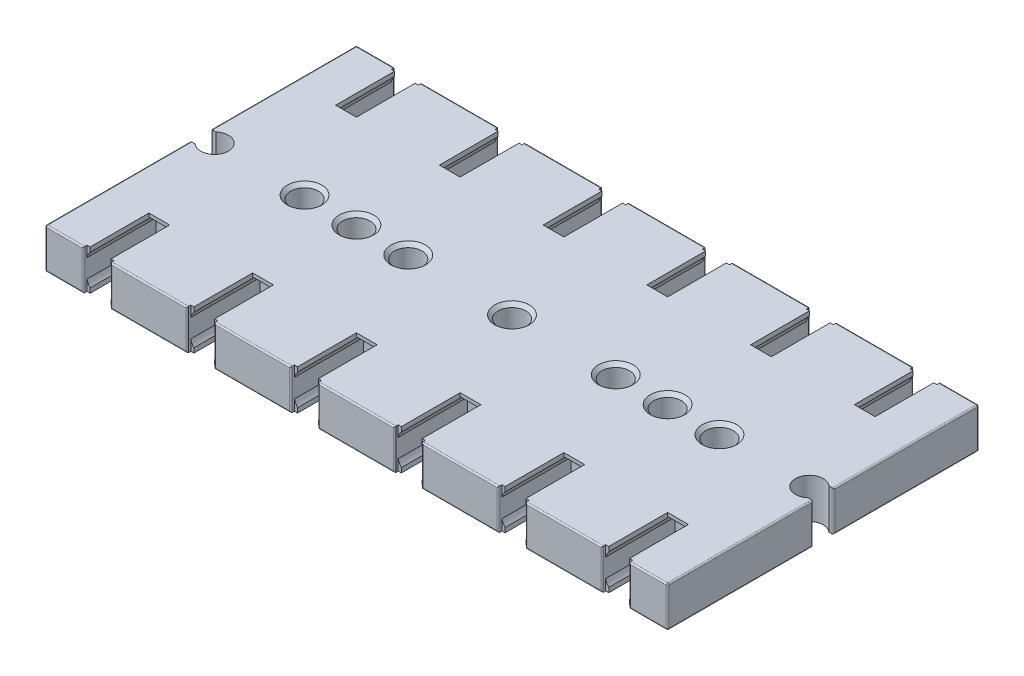
from build123d import *

# Parameters (mm, degrees)
SKETCH_1_W                        = 90
SKETCH_1_H                        = 45
EXTRUDE_1_DEPTH                   = 5.8
CUT_EXTRUDE_2_DEPTH               = 10.5
SKETCH_3_W                        = 3.9
SKETCH_3_H                        = 5.8
CUT_EXTRUDE_3_DEPTH               = 0.5
SKETCH_4_W                        = 3
SKETCH_4_H                        = 0.5
EXTRUDE_2_DEPTH                   = 1.5
PATTERN_LINEAR_1_COUNT            = 6
PATTERN_LINEAR_1_PITCH            = 15
PATTERN_LINEAR_1_COPY_1_DEPTH     = 10.5
PATTERN_LINEAR_1_COPY_2_DEPTH     = 10.5
PATTERN_LINEAR_1_COPY_3_DEPTH     = 10.5
PATTERN_LINEAR_1_COPY_4_DEPTH     = 10.5
PATTERN_LINEAR_1_COPY_5_DEPTH     = 10.5
PATTERN_LINEAR_1_COPY_6_SKETCH_W  = 3.9
PATTERN_LINEAR_1_COPY_6_SKETCH_H  = 5.8
PATTERN_LINEAR_1_COPY_6_DEPTH     = 0.5
PATTERN_LINEAR_1_COPY_7_SKETCH_W  = 3.9
PATTERN_LINEAR_1_COPY_7_SKETCH_H  = 5.8
PATTERN_LINEAR_1_COPY_7_DEPTH     = 0.5
PATTERN_LINEAR_1_COPY_8_SKETCH_W  = 3.9
PATTERN_LINEAR_1_COPY_8_SKETCH_H  = 5.8
PATTERN_LINEAR_1_COPY_8_DEPTH     = 0.5
PATTERN_LINEAR_1_COPY_9_SKETCH_W  = 3.9
PATTERN_LINEAR_1_COPY_9_SKETCH_H  = 5.8
PATTERN_LINEAR_1_COPY_9_DEPTH     = 0.5
PATTERN_LINEAR_1_COPY_10_SKETCH_W = 3.9
PATTERN_LINEAR_1_COPY_10_SKETCH_H = 5.8
PATTERN_LINEAR_1_COPY_10_DEPTH    = 0.5
PATTERN_LINEAR_1_COPY_11_SKETCH_W = 3
PATTERN_LINEAR_1_COPY_11_SKETCH_H = 0.5
PATTERN_LINEAR_1_COPY_11_DEPTH    = 1.5
PATTERN_LINEAR_1_COPY_12_SKETCH_W = 3
PATTERN_LINEAR_1_COPY_12_SKETCH_H = 0.5
PATTERN_LINEAR_1_COPY_12_DEPTH    = 1.5
PATTERN_LINEAR_1_COPY_13_SKETCH_W = 3
PATTERN_LINEAR_1_COPY_13_SKETCH_H = 0.5
PATTERN_LINEAR_1_COPY_13_DEPTH    = 1.5
PATTERN_LINEAR_1_COPY_14_SKETCH_W = 3
PATTERN_LINEAR_1_COPY_14_SKETCH_H = 0.5
PATTERN_LINEAR_1_COPY_14_DEPTH    = 1.5
PATTERN_LINEAR_1_COPY_15_SKETCH_W = 3
PATTERN_LINEAR_1_COPY_15_SKETCH_H = 0.5
PATTERN_LINEAR_1_COPY_15_DEPTH    = 1.5
CUT_EXTRUDE_4_REACH               = 52.645
SKETCH_5_R                        = 2
PATTERN_LINEAR_4_COUNT            = 3
PATTERN_LINEAR_4_PITCH            = 15
PATTERN_LINEAR_4_COL_COUNT        = 3
PATTERN_LINEAR_4_COL_PITCH        = 15
CUT_EXTRUDE_5_REACH               = 52.645
SKETCH_6_R                        = 2
CUT_EXTRUDE_6_REACH               = 52.645
CHAMFER_2_SIZE                    = 0.5
FILLET_2_R                        = 0.2


with BuildPart() as part:
    # 草图1 → 凸台-拉伸1 (new body)
    with BuildSketch(Plane(origin=(0, 0, 0), x_dir=(1, 0, 0), z_dir=(0, 1, 0))):
        Rectangle(SKETCH_1_W, SKETCH_1_H)
    extrude(amount=EXTRUDE_1_DEPTH)

    # 草图2 → 切除-拉伸2 (cut)
    with BuildSketch(Plane.XY.offset(22.5)):
        with BuildLine():
            Line((-36, 5.8), (-39, 5.8))
            Line((-39, 5.8), (-39, 5.122875656))
            ThreePointArc((-39, 5.122875656), (-39.280042303, 4.711838473), (-39.45, 4.244409721))
            Line((-39.45, 4.244409721), (-39.45, 3))
            Line((-39.45, 3), (-39.45, 2.8))
            Line((-39.45, 2.8), (-39.45, 1.555590279))
            ThreePointArc((-39.45, 1.555590279), (-39.280042303, 1.088161527), (-39, 0.677124344))
            Line((-39, 0.677124344), (-39, 0))
            Line((-39, 0), (-36, 0))
            Line((-36, 0), (-36, 0.677124344))
            ThreePointArc((-36, 0.677124344), (-35.719957697, 1.088161527), (-35.55, 1.555590279))
            Line((-35.55, 1.555590279), (-35.55, 2.8))
            Line((-35.55, 2.8), (-35.55, 3))
            Line((-35.55, 3), (-35.55, 4.244409721))
            ThreePointArc((-35.55, 4.244409721), (-35.719957697, 4.711838473), (-36, 5.122875656))
            Line((-36, 5.122875656), (-36, 5.8))
        make_face()
    cut_extrude_2 = extrude(amount=-CUT_EXTRUDE_2_DEPTH, mode=Mode.SUBTRACT)

    # 草图3 → 切除-拉伸3 (cut)
    with BuildSketch(Plane.XY.offset(22.5)):
        with Locations((-37.5, 2.9)):
            Rectangle(SKETCH_3_W, SKETCH_3_H)
    cut_extrude_3 = extrude(amount=-CUT_EXTRUDE_3_DEPTH, mode=Mode.SUBTRACT)

    # 草图4 → 凸台-拉伸2 (add)
    with BuildSketch(Plane.XY.offset(12)):
        with Locations((-37.5, 5.55)):
            Rectangle(SKETCH_4_W, SKETCH_4_H)
        with Locations((-37.5, 0.25)):
            Rectangle(SKETCH_4_W, SKETCH_4_H)
    extrude_2 = extrude(amount=EXTRUDE_2_DEPTH)

    # 镜向1: 切除-拉伸2, 切除-拉伸3, 凸台-拉伸2 across plane
    add(cut_extrude_2.mirror(Plane.XY), mode=Mode.SUBTRACT)
    add(cut_extrude_3.mirror(Plane.XY), mode=Mode.SUBTRACT)
    add(extrude_2.mirror(Plane.XY))

    # 阵列(线性)1: 切除-拉伸2, 切除-拉伸3, 凸台-拉伸2 ×6
    with Locations(*[(i * PATTERN_LINEAR_1_PITCH, 0, 0) for i in range(1, PATTERN_LINEAR_1_COUNT)]):
        add(cut_extrude_2, mode=Mode.SUBTRACT)
        add(cut_extrude_3, mode=Mode.SUBTRACT)
        add(extrude_2)

    # 阵列(线性)1 copy 1 sketch → 阵列(线性)1 copy 1 (cut)
    with BuildSketch(Plane(origin=(15, 0, -22.5), x_dir=(1, 0, 0), z_dir=(0, 0, -1))):
        with BuildLine():
            Line((-36, -5.8), (-39, -5.8))
            Line((-39, -5.8), (-39, -5.122875656))
            ThreePointArc((-39, -5.122875656), (-39.280042303, -4.711838473), (-39.45, -4.244409721))
            Line((-39.45, -4.244409721), (-39.45, -3))
            Line((-39.45, -3), (-39.45, -2.8))
            Line((-39.45, -2.8), (-39.45, -1.555590279))
            ThreePointArc((-39.45, -1.555590279), (-39.280042303, -1.088161527), (-39, -0.677124344))
            Line((-39, -0.677124344), (-39, 0))
            Line((-39, 0), (-36, 0))
            Line((-36, 0), (-36, -0.677124344))
            ThreePointArc((-36, -0.677124344), (-35.719957697, -1.088161527), (-35.55, -1.555590279))
            Line((-35.55, -1.555590279), (-35.55, -2.8))
            Line((-35.55, -2.8), (-35.55, -3))
            Line((-35.55, -3), (-35.55, -4.244409721))
            ThreePointArc((-35.55, -4.244409721), (-35.719957697, -4.711838473), (-36, -5.122875656))
            Line((-36, -5.122875656), (-36, -5.8))
        make_face()
    extrude(amount=-PATTERN_LINEAR_1_COPY_1_DEPTH, mode=Mode.SUBTRACT)

    # 阵列(线性)1 copy 2 sketch → 阵列(线性)1 copy 2 (cut)
    with BuildSketch(Plane(origin=(30, 0, -22.5), x_dir=(1, 0, 0), z_dir=(0, 0, -1))):
        with BuildLine():
            Line((-36, -5.8), (-39, -5.8))
            Line((-39, -5.8), (-39, -5.122875656))
            ThreePointArc((-39, -5.122875656), (-39.280042303, -4.711838473), (-39.45, -4.244409721))
            Line((-39.45, -4.244409721), (-39.45, -3))
            Line((-39.45, -3), (-39.45, -2.8))
            Line((-39.45, -2.8), (-39.45, -1.555590279))
            ThreePointArc((-39.45, -1.555590279), (-39.280042303, -1.088161527), (-39, -0.677124344))
            Line((-39, -0.677124344), (-39, 0))
            Line((-39, 0), (-36, 0))
            Line((-36, 0), (-36, -0.677124344))
            ThreePointArc((-36, -0.677124344), (-35.719957697, -1.088161527), (-35.55, -1.555590279))
            Line((-35.55, -1.555590279), (-35.55, -2.8))
            Line((-35.55, -2.8), (-35.55, -3))
            Line((-35.55, -3), (-35.55, -4.244409721))
            ThreePointArc((-35.55, -4.244409721), (-35.719957697, -4.711838473), (-36, -5.122875656))
            Line((-36, -5.122875656), (-36, -5.8))
        make_face()
    extrude(amount=-PATTERN_LINEAR_1_COPY_2_DEPTH, mode=Mode.SUBTRACT)

    # 阵列(线性)1 copy 3 sketch → 阵列(线性)1 copy 3 (cut)
    with BuildSketch(Plane(origin=(45, 0, -22.5), x_dir=(1, 0, 0), z_dir=(0, 0, -1))):
        with BuildLine():
            Line((-36, -5.8), (-39, -5.8))
            Line((-39, -5.8), (-39, -5.122875656))
            ThreePointArc((-39, -5.122875656), (-39.280042303, -4.711838473), (-39.45, -4.244409721))
            Line((-39.45, -4.244409721), (-39.45, -3))
            Line((-39.45, -3), (-39.45, -2.8))
            Line((-39.45, -2.8), (-39.45, -1.555590279))
            ThreePointArc((-39.45, -1.555590279), (-39.280042303, -1.088161527), (-39, -0.677124344))
            Line((-39, -0.677124344), (-39, 0))
            Line((-39, 0), (-36, 0))
            Line((-36, 0), (-36, -0.677124344))
            ThreePointArc((-36, -0.677124344), (-35.719957697, -1.088161527), (-35.55, -1.555590279))
            Line((-35.55, -1.555590279), (-35.55, -2.8))
            Line((-35.55, -2.8), (-35.55, -3))
            Line((-35.55, -3), (-35.55, -4.244409721))
            ThreePointArc((-35.55, -4.244409721), (-35.719957697, -4.711838473), (-36, -5.122875656))
            Line((-36, -5.122875656), (-36, -5.8))
        make_face()
    extrude(amount=-PATTERN_LINEAR_1_COPY_3_DEPTH, mode=Mode.SUBTRACT)

    # 阵列(线性)1 copy 4 sketch → 阵列(线性)1 copy 4 (cut)
    with BuildSketch(Plane(origin=(60, 0, -22.5), x_dir=(1, 0, 0), z_dir=(0, 0, -1))):
        with BuildLine():
            Line((-36, -5.8), (-39, -5.8))
            Line((-39, -5.8), (-39, -5.122875656))
            ThreePointArc((-39, -5.122875656), (-39.280042303, -4.711838473), (-39.45, -4.244409721))
            Line((-39.45, -4.244409721), (-39.45, -3))
            Line((-39.45, -3), (-39.45, -2.8))
            Line((-39.45, -2.8), (-39.45, -1.555590279))
            ThreePointArc((-39.45, -1.555590279), (-39.280042303, -1.088161527), (-39, -0.677124344))
            Line((-39, -0.677124344), (-39, 0))
            Line((-39, 0), (-36, 0))
            Line((-36, 0), (-36, -0.677124344))
            ThreePointArc((-36, -0.677124344), (-35.719957697, -1.088161527), (-35.55, -1.555590279))
            Line((-35.55, -1.555590279), (-35.55, -2.8))
            Line((-35.55, -2.8), (-35.55, -3))
            Line((-35.55, -3), (-35.55, -4.244409721))
            ThreePointArc((-35.55, -4.244409721), (-35.719957697, -4.711838473), (-36, -5.122875656))
            Line((-36, -5.122875656), (-36, -5.8))
        make_face()
    extrude(amount=-PATTERN_LINEAR_1_COPY_4_DEPTH, mode=Mode.SUBTRACT)

    # 阵列(线性)1 copy 5 sketch → 阵列(线性)1 copy 5 (cut)
    with BuildSketch(Plane(origin=(75, 0, -22.5), x_dir=(1, 0, 0), z_dir=(0, 0, -1))):
        with BuildLine():
            Line((-36, -5.8), (-39, -5.8))
            Line((-39, -5.8), (-39, -5.122875656))
            ThreePointArc((-39, -5.122875656), (-39.280042303, -4.711838473), (-39.45, -4.244409721))
            Line((-39.45, -4.244409721), (-39.45, -3))
            Line((-39.45, -3), (-39.45, -2.8))
            Line((-39.45, -2.8), (-39.45, -1.555590279))
            ThreePointArc((-39.45, -1.555590279), (-39.280042303, -1.088161527), (-39, -0.677124344))
            Line((-39, -0.677124344), (-39, 0))
            Line((-39, 0), (-36, 0))
            Line((-36, 0), (-36, -0.677124344))
            ThreePointArc((-36, -0.677124344), (-35.719957697, -1.088161527), (-35.55, -1.555590279))
            Line((-35.55, -1.555590279), (-35.55, -2.8))
            Line((-35.55, -2.8), (-35.55, -3))
            Line((-35.55, -3), (-35.55, -4.244409721))
            ThreePointArc((-35.55, -4.244409721), (-35.719957697, -4.711838473), (-36, -5.122875656))
            Line((-36, -5.122875656), (-36, -5.8))
        make_face()
    extrude(amount=-PATTERN_LINEAR_1_COPY_5_DEPTH, mode=Mode.SUBTRACT)

    # 阵列(线性)1 copy 6 sketch → 阵列(线性)1 copy 6 (cut)
    with BuildSketch(Plane(origin=(15, 0, -22.5), x_dir=(1, 0, 0), z_dir=(0, 0, -1))):
        with Locations((-37.5, -2.9)):
            Rectangle(PATTERN_LINEAR_1_COPY_6_SKETCH_W, PATTERN_LINEAR_1_COPY_6_SKETCH_H)
    extrude(amount=-PATTERN_LINEAR_1_COPY_6_DEPTH, mode=Mode.SUBTRACT)

    # 阵列(线性)1 copy 7 sketch → 阵列(线性)1 copy 7 (cut)
    with BuildSketch(Plane(origin=(30, 0, -22.5), x_dir=(1, 0, 0), z_dir=(0, 0, -1))):
        with Locations((-37.5, -2.9)):
            Rectangle(PATTERN_LINEAR_1_COPY_7_SKETCH_W, PATTERN_LINEAR_1_COPY_7_SKETCH_H)
    extrude(amount=-PATTERN_LINEAR_1_COPY_7_DEPTH, mode=Mode.SUBTRACT)

    # 阵列(线性)1 copy 8 sketch → 阵列(线性)1 copy 8 (cut)
    with BuildSketch(Plane(origin=(45, 0, -22.5), x_dir=(1, 0, 0), z_dir=(0, 0, -1))):
        with Locations((-37.5, -2.9)):
            Rectangle(PATTERN_LINEAR_1_COPY_8_SKETCH_W, PATTERN_LINEAR_1_COPY_8_SKETCH_H)
    extrude(amount=-PATTERN_LINEAR_1_COPY_8_DEPTH, mode=Mode.SUBTRACT)

    # 阵列(线性)1 copy 9 sketch → 阵列(线性)1 copy 9 (cut)
    with BuildSketch(Plane(origin=(60, 0, -22.5), x_dir=(1, 0, 0), z_dir=(0, 0, -1))):
        with Locations((-37.5, -2.9)):
            Rectangle(PATTERN_LINEAR_1_COPY_9_SKETCH_W, PATTERN_LINEAR_1_COPY_9_SKETCH_H)
    extrude(amount=-PATTERN_LINEAR_1_COPY_9_DEPTH, mode=Mode.SUBTRACT)

    # 阵列(线性)1 copy 10 sketch → 阵列(线性)1 copy 10 (cut)
    with BuildSketch(Plane(origin=(75, 0, -22.5), x_dir=(1, 0, 0), z_dir=(0, 0, -1))):
        with Locations((-37.5, -2.9)):
            Rectangle(PATTERN_LINEAR_1_COPY_10_SKETCH_W, PATTERN_LINEAR_1_COPY_10_SKETCH_H)
    extrude(amount=-PATTERN_LINEAR_1_COPY_10_DEPTH, mode=Mode.SUBTRACT)

    # 阵列(线性)1 copy 11 sketch → 阵列(线性)1 copy 11 (add)
    with BuildSketch(Plane(origin=(15, 0, -12), x_dir=(1, 0, 0), z_dir=(0, 0, -1))):
        with Locations((-37.5, -5.55)):
            Rectangle(PATTERN_LINEAR_1_COPY_11_SKETCH_W, PATTERN_LINEAR_1_COPY_11_SKETCH_H)
        with Locations((-37.5, -0.25)):
            Rectangle(PATTERN_LINEAR_1_COPY_11_SKETCH_W, PATTERN_LINEAR_1_COPY_11_SKETCH_H)
    extrude(amount=PATTERN_LINEAR_1_COPY_11_DEPTH)

    # 阵列(线性)1 copy 12 sketch → 阵列(线性)1 copy 12 (add)
    with BuildSketch(Plane(origin=(30, 0, -12), x_dir=(1, 0, 0), z_dir=(0, 0, -1))):
        with Locations((-37.5, -5.55)):
            Rectangle(PATTERN_LINEAR_1_COPY_12_SKETCH_W, PATTERN_LINEAR_1_COPY_12_SKETCH_H)
        with Locations((-37.5, -0.25)):
            Rectangle(PATTERN_LINEAR_1_COPY_12_SKETCH_W, PATTERN_LINEAR_1_COPY_12_SKETCH_H)
    extrude(amount=PATTERN_LINEAR_1_COPY_12_DEPTH)

    # 阵列(线性)1 copy 13 sketch → 阵列(线性)1 copy 13 (add)
    with BuildSketch(Plane(origin=(45, 0, -12), x_dir=(1, 0, 0), z_dir=(0, 0, -1))):
        with Locations((-37.5, -5.55)):
            Rectangle(PATTERN_LINEAR_1_COPY_13_SKETCH_W, PATTERN_LINEAR_1_COPY_13_SKETCH_H)
        with Locations((-37.5, -0.25)):
            Rectangle(PATTERN_LINEAR_1_COPY_13_SKETCH_W, PATTERN_LINEAR_1_COPY_13_SKETCH_H)
    extrude(amount=PATTERN_LINEAR_1_COPY_13_DEPTH)

    # 阵列(线性)1 copy 14 sketch → 阵列(线性)1 copy 14 (add)
    with BuildSketch(Plane(origin=(60, 0, -12), x_dir=(1, 0, 0), z_dir=(0, 0, -1))):
        with Locations((-37.5, -5.55)):
            Rectangle(PATTERN_LINEAR_1_COPY_14_SKETCH_W, PATTERN_LINEAR_1_COPY_14_SKETCH_H)
        with Locations((-37.5, -0.25)):
            Rectangle(PATTERN_LINEAR_1_COPY_14_SKETCH_W, PATTERN_LINEAR_1_COPY_14_SKETCH_H)
    extrude(amount=PATTERN_LINEAR_1_COPY_14_DEPTH)

    # 阵列(线性)1 copy 15 sketch → 阵列(线性)1 copy 15 (add)
    with BuildSketch(Plane(origin=(75, 0, -12), x_dir=(1, 0, 0), z_dir=(0, 0, -1))):
        with Locations((-37.5, -5.55)):
            Rectangle(PATTERN_LINEAR_1_COPY_15_SKETCH_W, PATTERN_LINEAR_1_COPY_15_SKETCH_H)
        with Locations((-37.5, -0.25)):
            Rectangle(PATTERN_LINEAR_1_COPY_15_SKETCH_W, PATTERN_LINEAR_1_COPY_15_SKETCH_H)
    extrude(amount=PATTERN_LINEAR_1_COPY_15_DEPTH)

    # 草图5 → 切除-拉伸4 (cut, up to next)
    with BuildSketch(Plane(origin=(0, 5.8, 0), x_dir=(1, 0, 0), z_dir=(0, 1, 0)), mode=Mode.PRIVATE) as cut_extrude_4_sk1:
        with Locations(Location((0, 0, 0), (0, 0, 270))):
            Circle(SKETCH_5_R)
    cut_extrude_4_tool1 = extrude(cut_extrude_4_sk1.sketch, amount=-CUT_EXTRUDE_4_REACH, mode=Mode.PRIVATE) & part.part
    cut_extrude_4 = cut_extrude_4_tool1.solids().sort_by_distance((0, 5.8, 0))[0]
    add(cut_extrude_4, mode=Mode.SUBTRACT)

    # 阵列(线性)4: 切除-拉伸4 ×3
    with Locations(*[(-i * PATTERN_LINEAR_4_PITCH, 0, 0) for i in range(1, PATTERN_LINEAR_4_COUNT)]):
        add(cut_extrude_4, mode=Mode.SUBTRACT)

    # 阵列(线性)4 col: 切除-拉伸4 ×3
    with Locations(*[(i * PATTERN_LINEAR_4_COL_PITCH, 0, 0) for i in range(1, PATTERN_LINEAR_4_COL_COUNT)]):
        add(cut_extrude_4, mode=Mode.SUBTRACT)

    # 草图6 → 切除-拉伸5 (cut, up to next)
    with BuildSketch(Plane(origin=(0, 5.8, 0), x_dir=(1, 0, 0), z_dir=(0, 1, 0)), mode=Mode.PRIVATE) as cut_extrude_5_sk1:
        with Locations(Location((-22.5, 0, 0), (0, 0, 270))):
            Circle(SKETCH_6_R)
    cut_extrude_5_tool1 = extrude(cut_extrude_5_sk1.sketch, amount=-CUT_EXTRUDE_5_REACH, mode=Mode.PRIVATE) & part.part
    cut_extrude_5 = cut_extrude_5_tool1.solids().sort_by_distance((-22.5, 5.8, 0))[0]
    add(cut_extrude_5, mode=Mode.SUBTRACT)

    # 镜向2: 切除-拉伸5 across plane
    add(cut_extrude_5.mirror(Plane(origin=(0, 0, 0), x_dir=(0, 0, 1), z_dir=(1, 0, 0))), mode=Mode.SUBTRACT)

    # 草图7 → 切除-拉伸6 (cut, up to next)
    with BuildSketch(Plane(origin=(0, 5.8, 0), x_dir=(1, 0, 0), z_dir=(0, 1, 0)), mode=Mode.PRIVATE) as cut_extrude_6_sk1:
        with BuildLine():
            Line((-45, -1.5), (-45, 1.5))
            Line((-45, 1.5), (-44.322875656, 1.5))
            ThreePointArc((-44.322875656, 1.5), (-41, 0), (-44.322875656, -1.5))
            Line((-44.322875656, -1.5), (-45, -1.5))
        make_face()
    cut_extrude_6_tool1 = extrude(cut_extrude_6_sk1.sketch, amount=-CUT_EXTRUDE_6_REACH, mode=Mode.PRIVATE) & part.part
    cut_extrude_6 = cut_extrude_6_tool1.solids().sort_by_distance((-43.085293, 5.8, 0))[0]
    add(cut_extrude_6, mode=Mode.SUBTRACT)

    # 镜向3: 切除-拉伸6 across plane
    add(cut_extrude_6.mirror(Plane(origin=(0, 0, 0), x_dir=(0, 0, 1), z_dir=(1, 0, 0))), mode=Mode.SUBTRACT)

    # 倒角2
    chamfer_2_edges = [part.edges().sort_by_distance(p)[0] for p in [
        (0, 0, -2),
        (0, 5.8, -2),
        (15, 0, -2),
        (15, 5.8, -2),
        (30, 0, -2),
        (30, 5.8, -2),
        (-15, 0, -2),
        (-15, 5.8, -2),
        (-30, 0, -2),
        (-30, 5.8, -2),
        (-22.5, 0, -2),
        (-22.5, 5.8, -2),
        (22.5, 5.8, -2),
        (22.5, 0, -2),
    ]]
    chamfer(chamfer_2_edges, length=CHAMFER_2_SIZE)

    # 圆角2
    fillet_2_edges = [part.edges().sort_by_distance(p)[0] for p in [
        (42.225, 5.8, -22.5),
        (-15, 0, 22.5),
        (-15, 5.8, 22.5),
        (0, 0, 22.5),
        (0, 5.8, 22.5),
        (15, 0, 22.5),
        (15, 5.8, 22.5),
        (30, 0, 22.5),
        (30, 5.8, 22.5),
        (42.225, 0, 22.5),
        (42.225, 5.8, 22.5),
        (-45, 5.8, -12),
        (-35.55, 2.9, -22.5),
        (-45, 0, 12),
        (-45, 5.8, 12),
        (-39.45, 2.9, -22.5),
        (-45, 2.9, 1.5),
        (-45, 2.9, -1.5),
        (45, 0, -12),
        (45, 5.8, -12),
        (45, 2.9, -1.5),
        (45, 2.9, 1.5),
        (-42.225, 0, -22.5),
        (-42.225, 5.8, -22.5),
        (-20.55, 2.9, -22.5),
        (-24.45, 2.9, -22.5),
        (-35.55, 2.9, 22.5),
        (-30, 0, -22.5),
        (-39.45, 2.9, 22.5),
        (-30, 5.8, -22.5),
        (-5.55, 2.9, -22.5),
        (-9.45, 2.9, -22.5),
        (-42.225, 5.8, 22.5),
        (-15, 0, -22.5),
        (-15, 5.8, -22.5),
        (-45, 0, -12),
        (9.45, 2.9, -22.5),
        (5.55, 2.9, -22.5),
        (42.225, 0, -22.5),
        (0, 0, -22.5),
        (0, 5.8, -22.5),
        (45, 0, 12),
        (-42.225, 0, 22.5),
        (24.45, 2.9, -22.5),
        (20.55, 2.9, -22.5),
        (-30, 0, 22.5),
        (15, 0, -22.5),
        (15, 5.8, -22.5),
        (-30, 5.8, 22.5),
        (45, 5.8, 12),
        (39.45, 2.9, -22.5),
        (35.55, 2.9, -22.5),
        (-45, 2.9, 22.5),
        (30, 0, -22.5),
        (30, 5.8, -22.5),
        (-45, 2.9, -22.5),
        (45, 2.9, -22.5),
        (45, 2.9, 22.5),
        (-20.55, 2.9, 22.5),
        (-24.45, 2.9, 22.5),
        (-5.55, 2.9, 22.5),
        (-9.45, 2.9, 22.5),
        (9.45, 2.9, 22.5),
        (5.55, 2.9, 22.5),
        (24.45, 2.9, 22.5),
        (20.55, 2.9, 22.5),
        (39.45, 2.9, 22.5),
        (35.55, 2.9, 22.5),
    ]]
    fillet(fillet_2_edges, radius=FILLET_2_R)


solid = part.part
